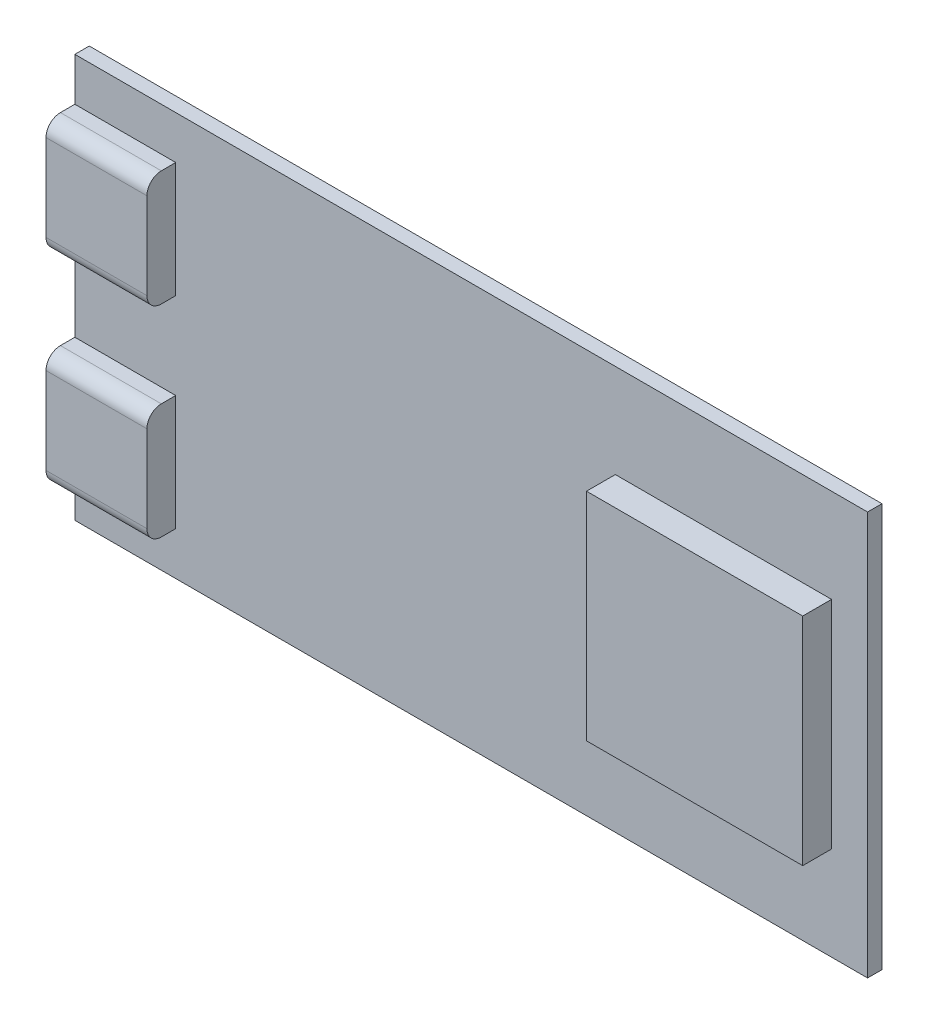
from build123d import *

# Parameters (mm, degrees)
SKETCH_1_W      = 55
SKETCH_1_H      = 28
EXTRUDE_1_DEPTH = 1
SKETCH_2_W      = 15
SKETCH_2_H      = 15
EXTRUDE_2_DEPTH = 2
SKETCH_3_W      = 7
SKETCH_3_H      = 8
EXTRUDE_3_DEPTH = 2
FILLET_1_R      = 1


with BuildPart() as part:
    # 草图1 → 凸台-拉伸1 (new body)
    with BuildSketch(Plane.XY):
        Rectangle(SKETCH_1_W, SKETCH_1_H)
    extrude(amount=EXTRUDE_1_DEPTH)

    # 草图2 → 凸台-拉伸2 (add)
    with BuildSketch(Plane.XY.offset(1)):
        with Locations((17.5, 0)):
            Rectangle(SKETCH_2_W, SKETCH_2_H)
    extrude(amount=EXTRUDE_2_DEPTH)

    # 草图3 → 凸台-拉伸3 (add)
    with BuildSketch(Plane.XY.offset(1)):
        with Locations((-24, -7)):
            Rectangle(SKETCH_3_W, SKETCH_3_H)
        with Locations((-24, 7)):
            Rectangle(SKETCH_3_W, SKETCH_3_H)
    extrude(amount=EXTRUDE_3_DEPTH)

    # 圆角1
    fillet_1_edges = [part.edges().sort_by_distance(p)[0] for p in [
        (-24, 3, 3),
        (-24, 11, 3),
        (-24, -3, 3),
        (-24, -11, 3),
    ]]
    fillet(fillet_1_edges, radius=FILLET_1_R)


solid = part.part
